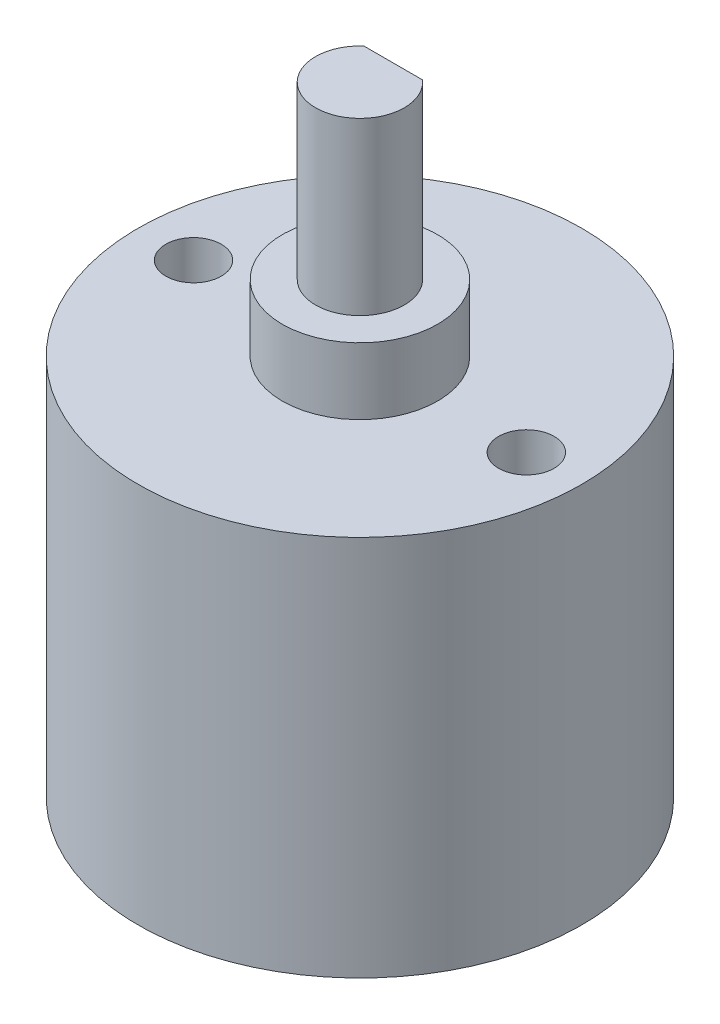
from build123d import *

# Parameters (mm, degrees)
SKETCH1_R           = 10
BOSS_EXTRUDE1_DEPTH = 17.2
SKETCH2_R           = 3.5
BOSS_EXTRUDE2_DEPTH = 3
BOSS_EXTRUDE3_DEPTH = 7.7
SKETCH4_R           = 1.25
CUT_EXTRUDE1_DEPTH  = 3.175


with BuildPart() as part:
    # Sketch1 → Boss-Extrude1 (new body)
    with BuildSketch(Plane(origin=(0, 0, 0), x_dir=(1, 0, 0), z_dir=(0, 1, 0))):
        with Locations(Location((0, 0, 0), (0, 0, 90))):
            Circle(SKETCH1_R)
    extrude(amount=BOSS_EXTRUDE1_DEPTH)

    # Sketch2 → Boss-Extrude2 (add)
    with BuildSketch(Plane(origin=(0, 17.2, 0), x_dir=(1, 0, 0), z_dir=(0, 1, 0))):
        with Locations(Location((0, 0, 0), (0, 0, 270))):
            Circle(SKETCH2_R)
    extrude(amount=BOSS_EXTRUDE2_DEPTH)

    # Sketch3 → Boss-Extrude3 (add)
    with BuildSketch(Plane(origin=(0, 20.2, 0), x_dir=(1, 0, 0), z_dir=(0, 1, 0))):
        with BuildLine():
            Line((1.322875656, 1.5), (-1.322875656, 1.5))
            ThreePointArc((-1.322875656, 1.5), (-0.822875656, -1.822875656), (2, 0))
            ThreePointArc((2, 0), (1.822875656, 0.822875656), (1.322875656, 1.5))
        make_face()
    extrude(amount=BOSS_EXTRUDE3_DEPTH)

    # Sketch4 → Cut-Extrude1 (cut)
    with BuildSketch(Plane(origin=(0, 17.2, 0), x_dir=(1, 0, 0), z_dir=(0, 1, 0))):
        with Locations(Location((-7.5, 0, 0), (0, 0, 270))):
            Circle(SKETCH4_R)
        with Locations(Location((7.5, 0, 0), (0, 0, 270))):
            Circle(SKETCH4_R)
    extrude(amount=-CUT_EXTRUDE1_DEPTH, mode=Mode.SUBTRACT)


solid = part.part
